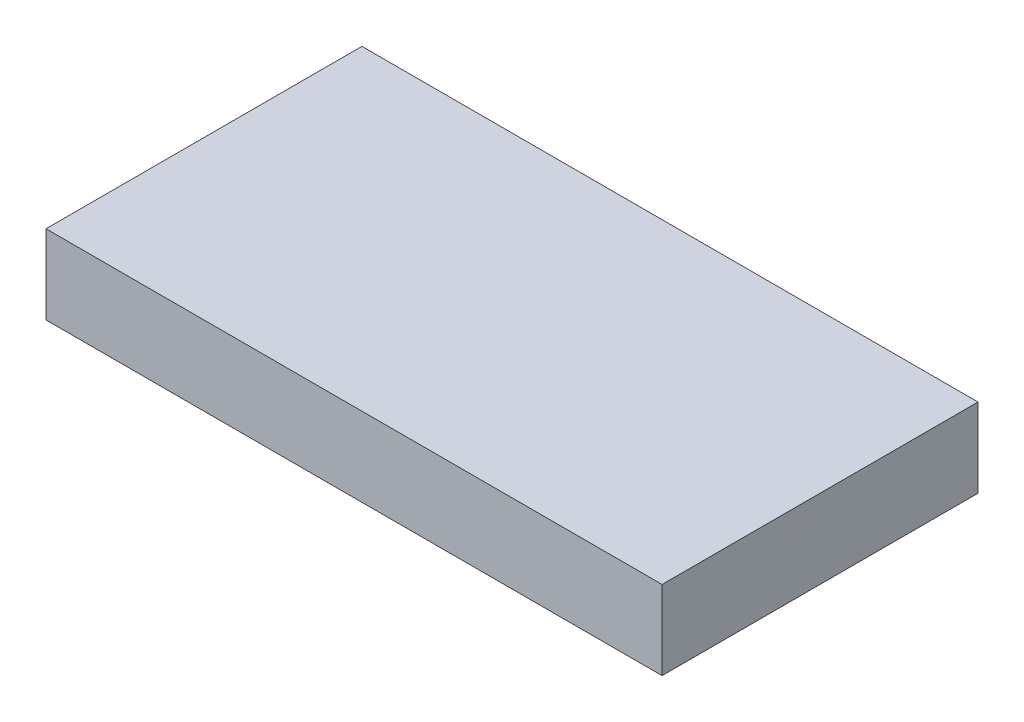
from build123d import *

# Parameters (mm, degrees)
SKETCH1_W           = 39
SKETCH1_H           = 5
BOSS_EXTRUDE1_DEPTH = 20


with BuildPart() as part:
    # Sketch1 → Boss-Extrude1 (new body)
    with BuildSketch(Plane.XY):
        with Locations((19.5, 2.5)):
            Rectangle(SKETCH1_W, SKETCH1_H)
    extrude(amount=BOSS_EXTRUDE1_DEPTH)


solid = part.part
